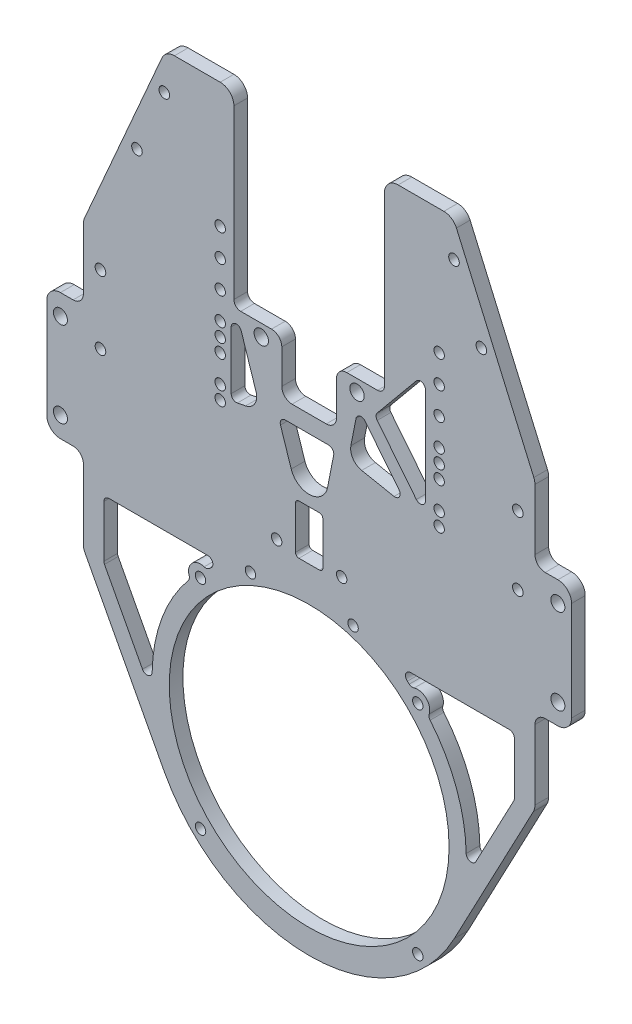
from build123d import *

# Parameters (mm, degrees)
SKETCH_1_R          = 40.9
SKETCH_1_R_2        = 1.525
SKETCH_1_R_3        = 2.1
EXTRUDE_1_DEPTH     = 4
EXTRUDE_2_DEPTH     = 4
SKETCH_2_R          = 1.525
CUT_EXTRUDE_1_DEPTH = 10
SKETCH_4_R          = 1.55
CUT_EXTRUDE_2_DEPTH = 10
CUT_EXTRUDE_3_DEPTH = 10
SKETCH_6_R          = 2.05
EXTRUDE_3_DEPTH     = 4
FILLET_1_R          = 3
FILLET_2_R          = 2
FILLET_3_R          = 4
CUT_EXTRUDE_4_DEPTH = 10
CUT_EXTRUDE_5_DEPTH = 10


with BuildPart() as part:
    # 草图1 → 凸台-拉伸1 (new body)
    with BuildSketch(Plane.XY):
        with BuildLine():
            Line((-48, 105.1), (48, 105.1))
            Line((48, 105.1), (66, 105.1))
            Line((66, 105.1), (66, 22.1))
            Line((66, 22.1), (42.426415371, -22.449928257))
            ThreePointArc((42.426415371, -22.449928257), (0, -48), (-42.426415371, -22.449928257))
            Line((-42.426415371, -22.449928257), (-66, 22.1))
            Line((-66, 22.1), (-66, 105.1))
            Line((-66, 105.1), (-48, 105.1))
        make_face()
        Circle(SKETCH_1_R, mode=Mode.SUBTRACT)
        with Locations((12.835117837, 41.981778787)):
            Circle(SKETCH_1_R_2, mode=Mode.SUBTRACT)
        with Locations((-17.153096541, 40.410163067)):
            Circle(SKETCH_1_R_2, mode=Mode.SUBTRACT)
        with Locations((-31.749094475, 31.749094475)):
            Circle(SKETCH_1_R_2, mode=Mode.SUBTRACT)
        with Locations((31.749094475, 31.749094475)):
            Circle(SKETCH_1_R_2, mode=Mode.SUBTRACT)
        with Locations((31.749094475, -31.749094475)):
            Circle(SKETCH_1_R_2, mode=Mode.SUBTRACT)
        with Locations((-31.749094475, -31.749094475)):
            Circle(SKETCH_1_R_2, mode=Mode.SUBTRACT)
        with Locations((-14, 101.6)):
            Circle(SKETCH_1_R_3, mode=Mode.SUBTRACT)
        with Locations((14, 101.6)):
            Circle(SKETCH_1_R_3, mode=Mode.SUBTRACT)
        with Locations((-9.5, 52.6)):
            Circle(SKETCH_1_R_2, mode=Mode.SUBTRACT)
        with Locations((9.5, 52.6)):
            Circle(SKETCH_1_R_2, mode=Mode.SUBTRACT)
    extrude(amount=EXTRUDE_1_DEPTH)

    # 草图3 → 凸台-拉伸2 (add)
    with BuildSketch(Plane.XY.offset(4)):
        Polygon((-66, 105.1), (-42, 160.1), (-22, 160.1), (-22, 105.1), align=None)
        Polygon((22, 160.1), (22, 105.1), (66, 105.1), (42, 160.1), align=None)
    extrude(amount=-EXTRUDE_2_DEPTH)

    # 草图2 → 切除-拉伸1 (cut)
    with BuildSketch(Plane.XY.offset(4)):
        with Locations((38, 99.6)):
            Circle(SKETCH_2_R)
        with Locations((38, 83.6)):
            Circle(SKETCH_2_R)
        with Locations((-26, 99.6)):
            Circle(SKETCH_2_R)
        with Locations((-26, 83.6)):
            Circle(SKETCH_2_R)
        with Locations((38, 107.6)):
            Circle(SKETCH_2_R)
        with Locations((38, 91.6)):
            Circle(SKETCH_2_R)
        with Locations((-26, 107.6)):
            Circle(SKETCH_2_R)
        with Locations((-26, 91.6)):
            Circle(SKETCH_2_R)
        with Locations((-26, 95.6)):
            Circle(SKETCH_2_R)
        with Locations((-26, 79.6)):
            Circle(SKETCH_2_R)
        with Locations((38, 95.6)):
            Circle(SKETCH_2_R)
        with Locations((38, 79.6)):
            Circle(SKETCH_2_R)
        with Locations((38, 115.6)):
            Circle(SKETCH_2_R)
        with Locations((-26, 115.6)):
            Circle(SKETCH_2_R)
        with Locations((38, 123.6)):
            Circle(SKETCH_2_R)
        with Locations((-26, 123.6)):
            Circle(SKETCH_2_R)
    extrude(amount=-CUT_EXTRUDE_1_DEPTH, mode=Mode.SUBTRACT)

    # 草图4 → 切除-拉伸2 (cut)
    with BuildSketch(Plane.XY.offset(4)):
        with Locations((-61, 95.1)):
            Circle(SKETCH_4_R)
        with Locations((-61, 75.1)):
            Circle(SKETCH_4_R)
        with Locations((-42.333287047, 149.334828392)):
            Circle(SKETCH_4_R)
        with Locations((-50.332176167, 131.004040825)):
            Circle(SKETCH_4_R)
        with Locations((61, 75.1)):
            Circle(SKETCH_4_R)
        with Locations((61, 95.1)):
            Circle(SKETCH_4_R)
        with Locations((50.332176167, 131.004040825)):
            Circle(SKETCH_4_R)
        with Locations((42.333287047, 149.334828392)):
            Circle(SKETCH_4_R)
    extrude(amount=-CUT_EXTRUDE_2_DEPTH, mode=Mode.SUBTRACT)

    # 草图5 → 切除-拉伸3 (cut)
    with BuildSketch(Plane.XY.offset(4)):
        with BuildLine():
            Line((-8, 105.1), (8, 105.1))
            Line((8, 105.1), (8, 92.1))
            ThreePointArc((8, 92.1), (7.121320344, 89.978679656), (5, 89.1))
            Line((5, 89.1), (-5, 89.1))
            ThreePointArc((-5, 89.1), (-7.121320344, 89.978679656), (-8, 92.1))
            Line((-8, 92.1), (-8, 105.1))
        make_face()
    extrude(amount=-CUT_EXTRUDE_3_DEPTH, mode=Mode.SUBTRACT)

    # 草图6 → 凸台-拉伸3 (add)
    # profile 1 of 2: a face of its own
    with BuildSketch(Plane.XY.offset(4)):
        with BuildLine():
            Line((-66, 83.5), (-72.7, 83.5))
            ThreePointArc((-72.7, 83.5), (-75.528427125, 82.328427125), (-76.7, 79.5))
            Line((-76.7, 79.5), (-76.7, 50.5))
            ThreePointArc((-76.7, 50.5), (-75.528427125, 47.671572875), (-72.7, 46.5))
            Line((-72.7, 46.5), (-66, 46.5))
            Line((-66, 46.5), (-66, 83.5))
        make_face()
        with Locations((-72.7, 77.5)):
            Circle(SKETCH_6_R, mode=Mode.SUBTRACT)
        with Locations((-72.7, 52.5)):
            Circle(SKETCH_6_R, mode=Mode.SUBTRACT)
    # profile 2 of 2: a face of its own
    with BuildSketch(Plane.XY.offset(4)):
        with BuildLine():
            Line((66, 46.5), (72.7, 46.5))
            ThreePointArc((72.7, 46.5), (75.528427125, 47.671572875), (76.7, 50.5))
            Line((76.7, 50.5), (76.7, 79.5))
            ThreePointArc((76.7, 79.5), (75.528427125, 82.328427125), (72.7, 83.5))
            Line((72.7, 83.5), (66, 83.5))
            Line((66, 83.5), (66, 46.5))
        make_face()
        with Locations((72.7, 52.5)):
            Circle(SKETCH_6_R, mode=Mode.SUBTRACT)
        with Locations((72.7, 77.5)):
            Circle(SKETCH_6_R, mode=Mode.SUBTRACT)
    extrude(amount=-EXTRUDE_3_DEPTH)

    # 圆角1
    fillet_1_edges = [part.edges().sort_by_distance(p)[0] for p in [
        (8, 105.1, 2),
        (-8, 105.1, 2),
        (-66, 46.5, 2),
        (-66, 83.5, 2),
        (66, 83.5, 2),
        (66, 46.5, 2),
    ]]
    fillet(fillet_1_edges, radius=FILLET_1_R)

    # 圆角2
    fillet_2_edges = [part.edges().sort_by_distance(p)[0] for p in [
        (-22, 105.1, 2),
        (22, 105.1, 2),
    ]]
    fillet(fillet_2_edges, radius=FILLET_2_R)

    # 圆角3
    fillet_3_edges = [part.edges().sort_by_distance(p)[0] for p in [
        (66, 105.1, 2),
        (66, 22.1, 2),
        (-66, 22.1, 2),
        (-66, 105.1, 2),
        (-42, 160.1, 2),
        (-22, 160.1, 2),
        (22, 160.1, 2),
        (42, 160.1, 2),
    ]]
    fillet(fillet_3_edges, radius=FILLET_3_R)

    # 草图7 → 切除-拉伸4 (cut)
    with BuildSketch(Plane.XY.offset(4)):
        with BuildLine():
            Line((60, 36.981778787), (60, 21.823913804))
            ThreePointArc((60, 21.823913804), (59.955805313, 21.462484849), (59.82582548, 21.122353546))
            Line((59.82582548, 21.122353546), (48.718504855, 0.131471388))
            ThreePointArc((48.718504855, 0.131471388), (47.044057399, -0.625893547), (45.89291104, 0.806669885))
            ThreePointArc((45.89291104, 0.806669885), (43.045328922, 15.934542916), (35.356268147, 29.270194785))
            ThreePointArc((35.356268147, 29.270194785), (35.038996291, 29.941888641), (35.082919565, 30.683444311))
            ThreePointArc((35.082919565, 30.683444311), (34.223968209, 34.223968209), (30.683444311, 35.082919565))
            ThreePointArc((30.683444311, 35.082919565), (29.941888641, 35.038996291), (29.270194785, 35.356268147))
            ThreePointArc((29.270194785, 35.356268147), (28.991727147, 35.584965323), (28.711472695, 35.811469331))
            ThreePointArc((28.711472695, 35.811469331), (28.234576944, 37.47903919), (29.649756116, 38.481778787))
            Line((29.649756116, 38.481778787), (58.5, 38.481778787))
            ThreePointArc((58.5, 38.481778787), (59.560660172, 38.042438959), (60, 36.981778787))
        make_face()
        with BuildLine():
            Line((-58.5, 38.481778787), (-29.649756116, 38.481778787))
            ThreePointArc((-29.649756116, 38.481778787), (-28.234576944, 37.47903919), (-28.711472695, 35.811469331))
            ThreePointArc((-28.711472695, 35.811469331), (-28.991727147, 35.584965323), (-29.270194785, 35.356268147))
            ThreePointArc((-29.270194785, 35.356268147), (-29.941888641, 35.038996291), (-30.683444311, 35.082919565))
            ThreePointArc((-30.683444311, 35.082919565), (-34.223968209, 34.223968209), (-35.082919565, 30.683444311))
            ThreePointArc((-35.082919565, 30.683444311), (-35.038996291, 29.941888641), (-35.356268147, 29.270194785))
            ThreePointArc((-35.356268147, 29.270194785), (-43.045328922, 15.934542916), (-45.89291104, 0.806669885))
            ThreePointArc((-45.89291104, 0.806669885), (-47.044057399, -0.625893547), (-48.718504855, 0.131471388))
            Line((-48.718504855, 0.131471388), (-59.82582548, 21.122353546))
            ThreePointArc((-59.82582548, 21.122353546), (-59.955805313, 21.462484849), (-60, 21.823913804))
            Line((-60, 21.823913804), (-60, 36.981778787))
            ThreePointArc((-60, 36.981778787), (-59.560660172, 38.042438959), (-58.5, 38.481778787))
        make_face()
        with BuildLine():
            Line((24.807871771, 80.652628352), (15.355900595, 82.50192706))
            ThreePointArc((15.355900595, 82.50192706), (12.804883031, 84.195051884), (12.198497234, 87.196161436))
            Line((12.198497234, 87.196161436), (13.693014403, 94.828435051))
            ThreePointArc((13.693014403, 94.828435051), (14.807559801, 95.996961686), (16.336432341, 95.477139889))
            Line((16.336432341, 95.477139889), (26.267263449, 83.061671081))
            ThreePointArc((26.267263449, 83.061671081), (26.378835615, 81.347511797), (24.807871771, 80.652628352))
        make_face()
        with BuildLine():
            Line((31.328625732, 83.137715881), (19.891021722, 97.436943637))
            ThreePointArc((19.891021722, 97.436943637), (19.562441174, 98.38554), (19.905707213, 99.328921505))
            Line((19.905707213, 99.328921505), (31.343311222, 113.181711094))
            ThreePointArc((31.343311222, 113.181711094), (33.007428238, 113.638252268), (34, 112.226686973))
            Line((34, 112.226686973), (34, 84.074669628))
            ThreePointArc((34, 84.074669628), (32.996456744, 82.659208325), (31.328625732, 83.137715881))
        make_face()
        with BuildLine():
            Line((-18.571891419, 81.872711464), (-21.001647198, 81.397324464))
            ThreePointArc((-21.001647198, 81.397324464), (-22.243072675, 81.711392265), (-22.789664608, 82.869413446))
            Line((-22.789664608, 82.869413446), (-22.789664608, 99.759994217))
            ThreePointArc((-22.789664608, 99.759994217), (-21.52644559, 101.241187913), (-19.864418253, 100.227618882))
            Line((-19.864418253, 100.227618882), (-15.539280898, 87.045281191))
            ThreePointArc((-15.539280898, 87.045281191), (-15.889266603, 83.775198304), (-18.571891419, 81.872711464))
        make_face()
        with BuildLine():
            Line((5.383074159, 73.206167796), (7.166088141, 82.311751092))
            ThreePointArc((7.166088141, 82.311751092), (6.852140616, 83.553317008), (5.694044471, 84.1))
            Line((5.694044471, 84.1), (-6.959568938, 84.1))
            ThreePointArc((-6.959568938, 84.1), (-8.174360483, 83.479932668), (-8.384815293, 82.132375335))
            Line((-8.384815293, 82.132375335), (-5.2403226, 72.548456688))
            ThreePointArc((-5.2403226, 72.548456688), (0.325443572, 68.773591119), (5.383074159, 73.206167796))
        make_face()
    extrude(amount=-CUT_EXTRUDE_4_DEPTH, mode=Mode.SUBTRACT)

    # 草图8 → 切除-拉伸5 (cut)
    with BuildSketch(Plane.XY.offset(4)):
        with BuildLine():
            Line((-3, 51.1), (3, 51.1))
            ThreePointArc((3, 51.1), (3.707106781, 51.392893219), (4, 52.1))
            Line((4, 52.1), (4, 64.6))
            ThreePointArc((4, 64.6), (3.707106781, 65.307106781), (3, 65.6))
            Line((3, 65.6), (-3, 65.6))
            ThreePointArc((-3, 65.6), (-3.707106781, 65.307106781), (-4, 64.6))
            Line((-4, 64.6), (-4, 52.1))
            ThreePointArc((-4, 52.1), (-3.707106781, 51.392893219), (-3, 51.1))
        make_face()
    extrude(amount=-CUT_EXTRUDE_5_DEPTH, mode=Mode.SUBTRACT)


solid = part.part
